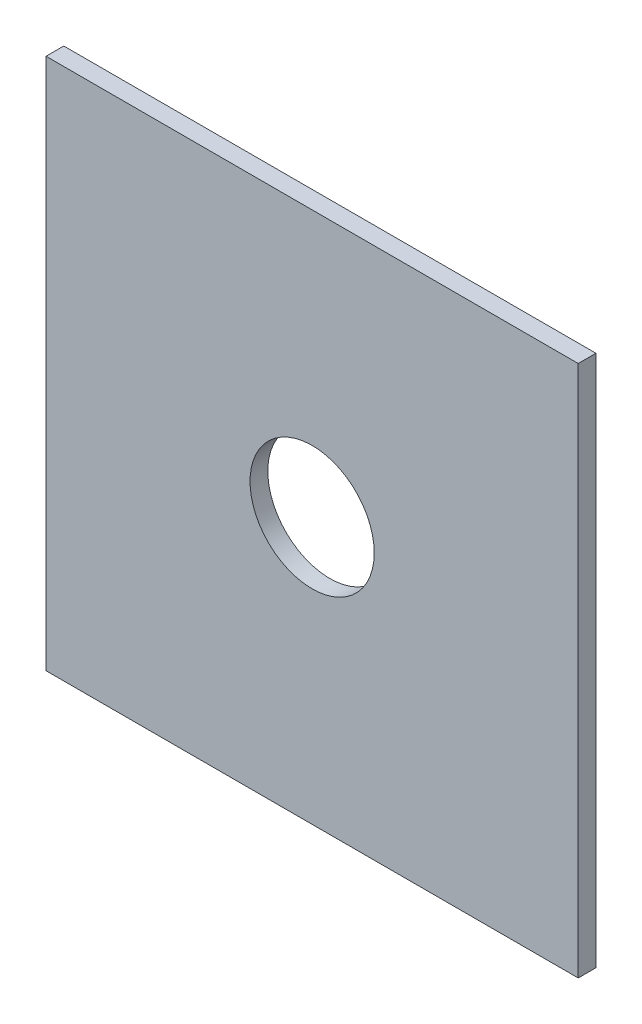
from build123d import *

# Parameters (mm, degrees)
CROQUIS1_W              = 15
CROQUIS1_H              = 15
SALIENTE_EXTRUIR1_DEPTH = 0.5
CROQUIS2_R              = 1.75
CORTAR_EXTRUIR1_DEPTH   = 0.5


with BuildPart() as part:
    # Croquis1 → Saliente-Extruir1 (new body)
    with BuildSketch(Plane.XY):
        Rectangle(CROQUIS1_W, CROQUIS1_H)
    extrude(amount=SALIENTE_EXTRUIR1_DEPTH)

    # Croquis2 → Cortar-Extruir1 (cut)
    with BuildSketch(Plane.XY.offset(0.5)):
        Circle(CROQUIS2_R)
    extrude(amount=-CORTAR_EXTRUIR1_DEPTH, mode=Mode.SUBTRACT)


solid = part.part
